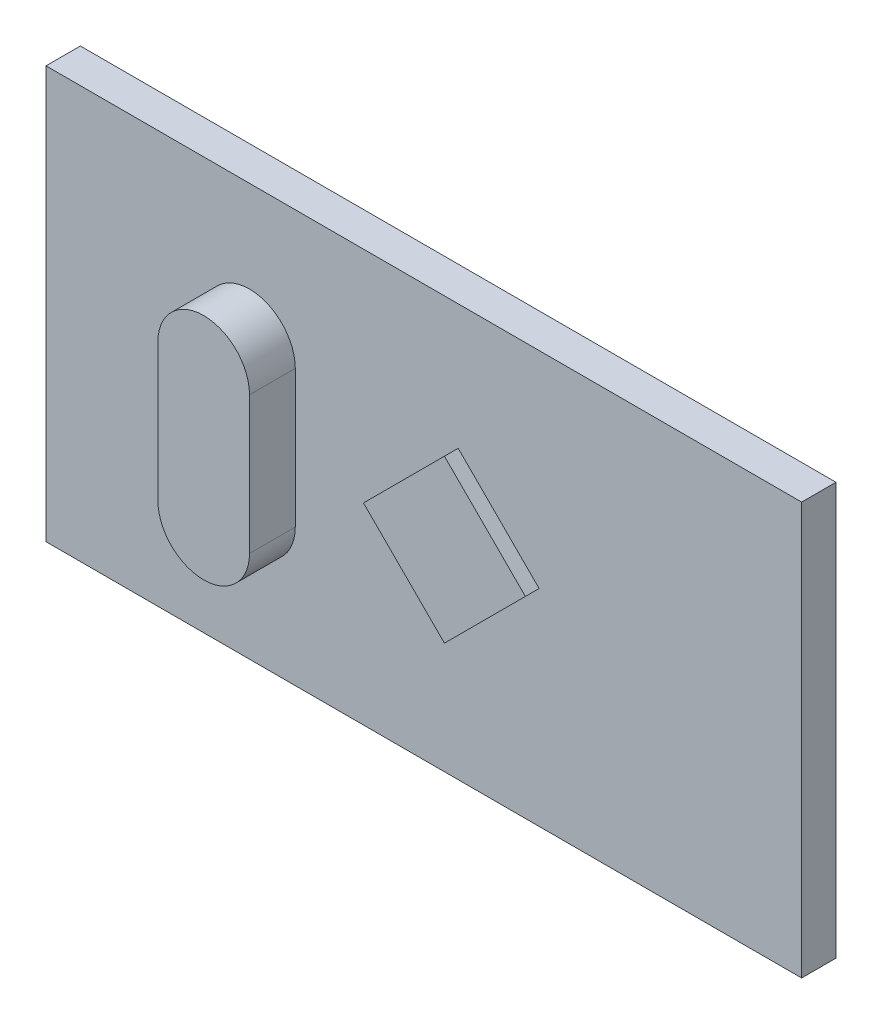
from build123d import *

# Parameters (mm, degrees)
SKETCH_1_W      = 33
SKETCH_1_H      = 18
EXTRUDE_1_DEPTH = 1.5
EXTRUDE_2_DEPTH = 0.6
EXTRUDE_3_DEPTH = 2


with BuildPart() as part:
    # Эскиз1 → Бобышка-Вытянуть1 (new body)
    with BuildSketch(Plane.XY):
        with Locations((16.5, 9)):
            Rectangle(SKETCH_1_W, SKETCH_1_H)
    extrude(amount=EXTRUDE_1_DEPTH)

    # Эскиз2 → Бобышка-Вытянуть2 (add)
    with BuildSketch(Plane.XY.offset(1.5)):
        Polygon((18, 12.535533906), (21.535533906, 9), (18, 5.464466094), (14.464466094, 9), align=None)
    extrude(amount=EXTRUDE_2_DEPTH)

    # Эскиз3 → Бобышка-Вытянуть3 (add)
    with BuildSketch(Plane.XY.offset(1.5)):
        with BuildLine():
            Line((6.886292912, 6), (6.886292912, 12))
            ThreePointArc((6.886292912, 12), (8.886292912, 14), (10.886292912, 12))
            Line((10.886292912, 12), (10.886292912, 6))
            ThreePointArc((10.886292912, 6), (8.886292912, 4), (6.886292912, 6))
        make_face()
    extrude(amount=EXTRUDE_3_DEPTH)


solid = part.part
